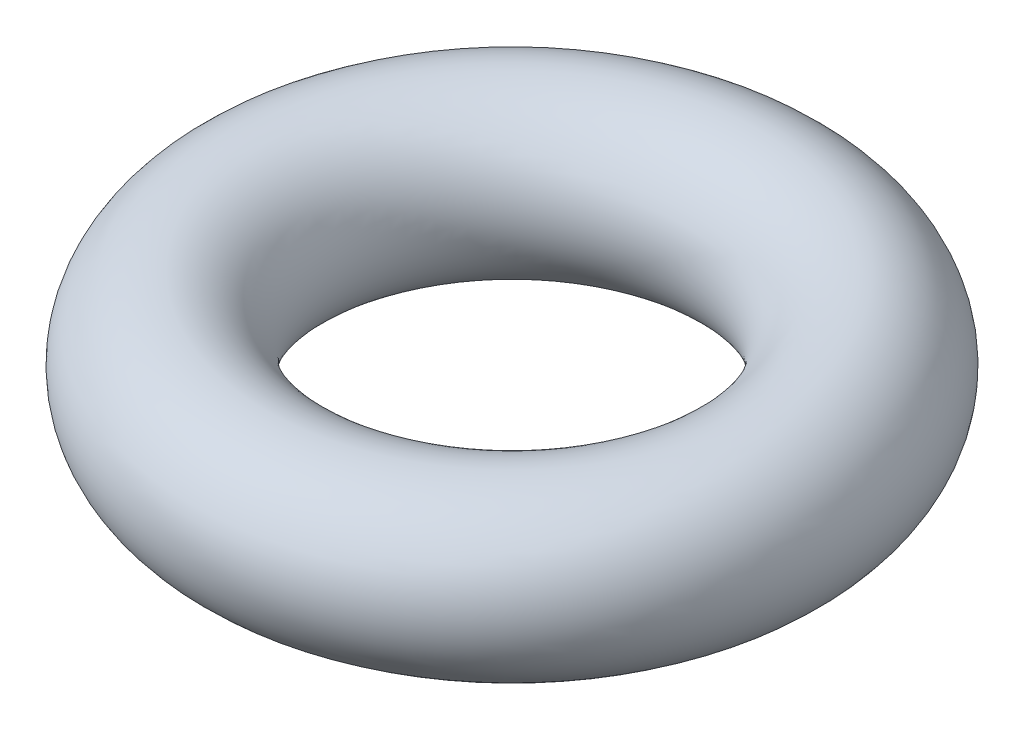
from build123d import *

# Parameters (mm, degrees)
SKETCH1_R = 0.79375


with BuildPart() as part:
    # Sketch1 → Revolve1 (revolve)
    with BuildSketch(Plane.XY, mode=Mode.PRIVATE) as revolve1_sk:
        with Locations((2.3876, 0)):
            Circle(SKETCH1_R)
    revolve(revolve1_sk.sketch.rotate(Axis((0, -29.929059085, 0), (0, 1, 0)), 90), axis=Axis((0, -29.929059085, 0), (0, 1, 0)))


solid = part.part
